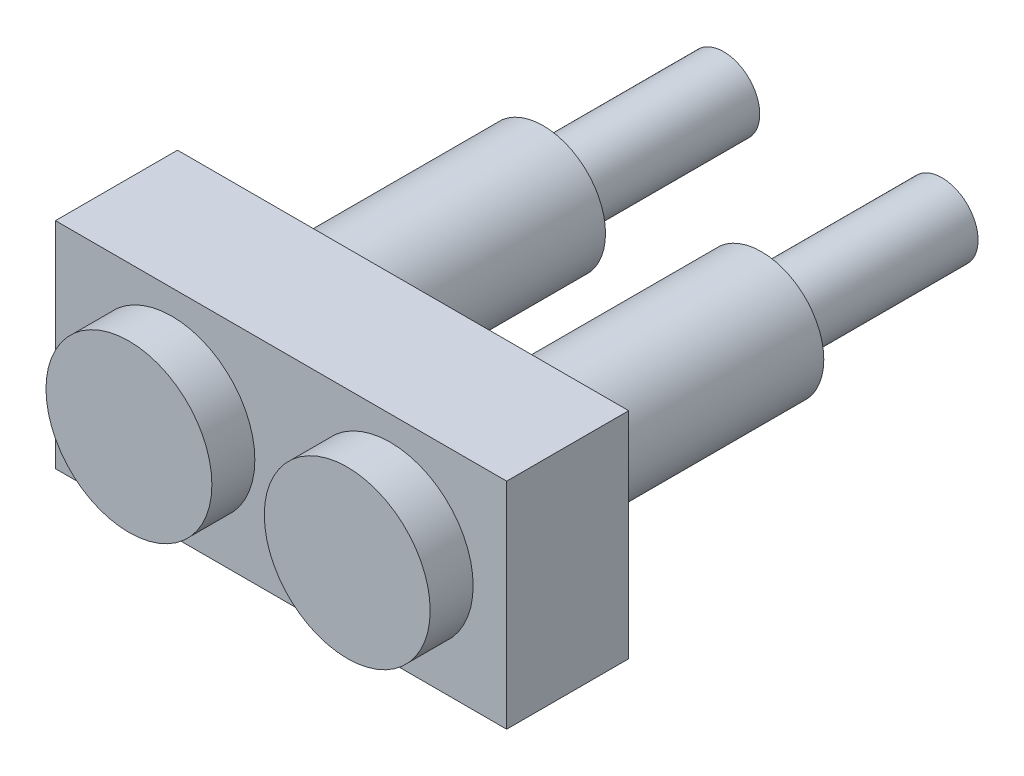
from build123d import *

# Parameters (mm, degrees)
SKETCH_1_W          = 5.25
SKETCH_1_H          = 2.5
EXTRUDE_1_DEPTH     = 1.42
SKETCH_2_R          = 0.725
EXTRUDE_2_DEPTH     = 5
SKETCH_3_R          = 0.965
EXTRUDE_3_DEPTH     = 0.5
CUT_EXTRUDE_START   = -2.1
SKETCH_4_R          = 0.725
SKETCH_4_R_2        = 0.42
CUT_EXTRUDE_1_DEPTH = 2.1


with BuildPart() as part:
    # ｽｹｯﾁ1 → ﾎﾞｽ - 押し出し1 (new body)
    with BuildSketch(Plane.XY):
        Rectangle(SKETCH_1_W, SKETCH_1_H)
    extrude(amount=EXTRUDE_1_DEPTH)

    # ｽｹｯﾁ2 → ﾎﾞｽ - 押し出し2 (add)
    with BuildSketch(Plane(origin=(0, 0, 0), x_dir=(-1, 0, 0), z_dir=(0, 0, -1))):
        with Locations(Location((-1.27, 0, 0), (0, 0, 180))):
            Circle(SKETCH_2_R)
        with Locations(Location((1.27, 0, 0), (0, 0, 180))):
            Circle(SKETCH_2_R)
    extrude(amount=EXTRUDE_2_DEPTH)

    # ｽｹｯﾁ3 → ﾎﾞｽ - 押し出し3 (add)
    with BuildSketch(Plane.XY.offset(1.42)):
        with Locations((-1.27, 0)):
            Circle(SKETCH_3_R)
        with Locations((1.27, 0)):
            Circle(SKETCH_3_R)
    extrude(amount=EXTRUDE_3_DEPTH)

    # ｽｹｯﾁ4 → ｶｯﾄ - 押し出し1 (cut)
    # profile 1 of 2: a face of its own
    with BuildSketch(Plane(origin=(0, 0, -5), x_dir=(-1, 0, 0), z_dir=(0, 0, -1)).offset(CUT_EXTRUDE_START)):
        with Locations(Location((-1.27, 0, 0), (0, 0, 180))):
            Circle(SKETCH_4_R)
        with Locations((-1.27, 0)):
            Circle(SKETCH_4_R_2, mode=Mode.SUBTRACT)
    # profile 2 of 2: a face of its own
    with BuildSketch(Plane(origin=(0, 0, -5), x_dir=(-1, 0, 0), z_dir=(0, 0, -1)).offset(CUT_EXTRUDE_START)):
        with Locations(Location((1.27, 0, 0), (0, 0, 180))):
            Circle(SKETCH_4_R)
        with Locations((1.27, 0)):
            Circle(SKETCH_4_R_2, mode=Mode.SUBTRACT)
    extrude(amount=CUT_EXTRUDE_1_DEPTH, mode=Mode.SUBTRACT)


solid = part.part
